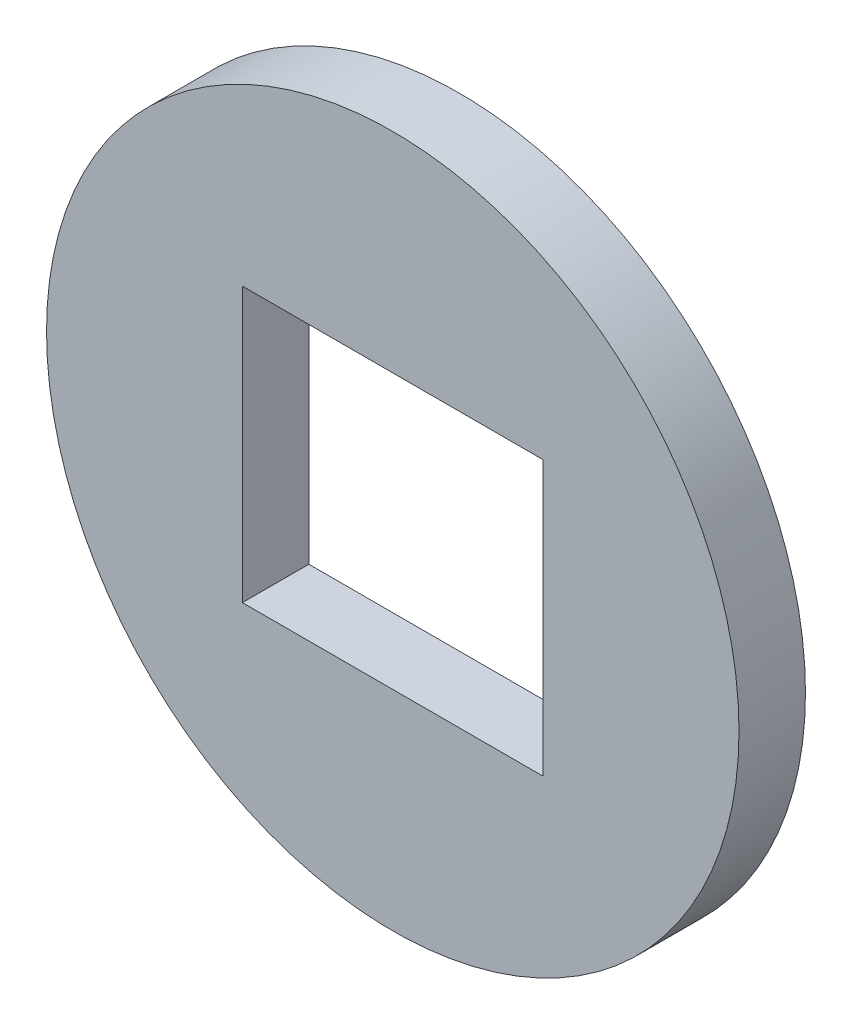
from build123d import *

# Parameters (mm, degrees)
SKETCH1_R           = 52.105052161
BOSS_EXTRUDE1_DEPTH = 10
SKETCH2_W           = 45.263653378
SKETCH2_H           = 41.248329288
CUT_EXTRUDE1_DEPTH  = 75.363115328


with BuildPart() as part:
    # Sketch1 → Boss-Extrude1 (new body)
    with BuildSketch(Plane.XY):
        Circle(SKETCH1_R)
    extrude(amount=BOSS_EXTRUDE1_DEPTH)

    # Sketch2 → Cut-Extrude1 (cut, through all)
    with BuildSketch(Plane.XY.offset(10)):
        Rectangle(SKETCH2_W, SKETCH2_H)
    extrude(amount=-CUT_EXTRUDE1_DEPTH, mode=Mode.SUBTRACT)


solid = part.part
